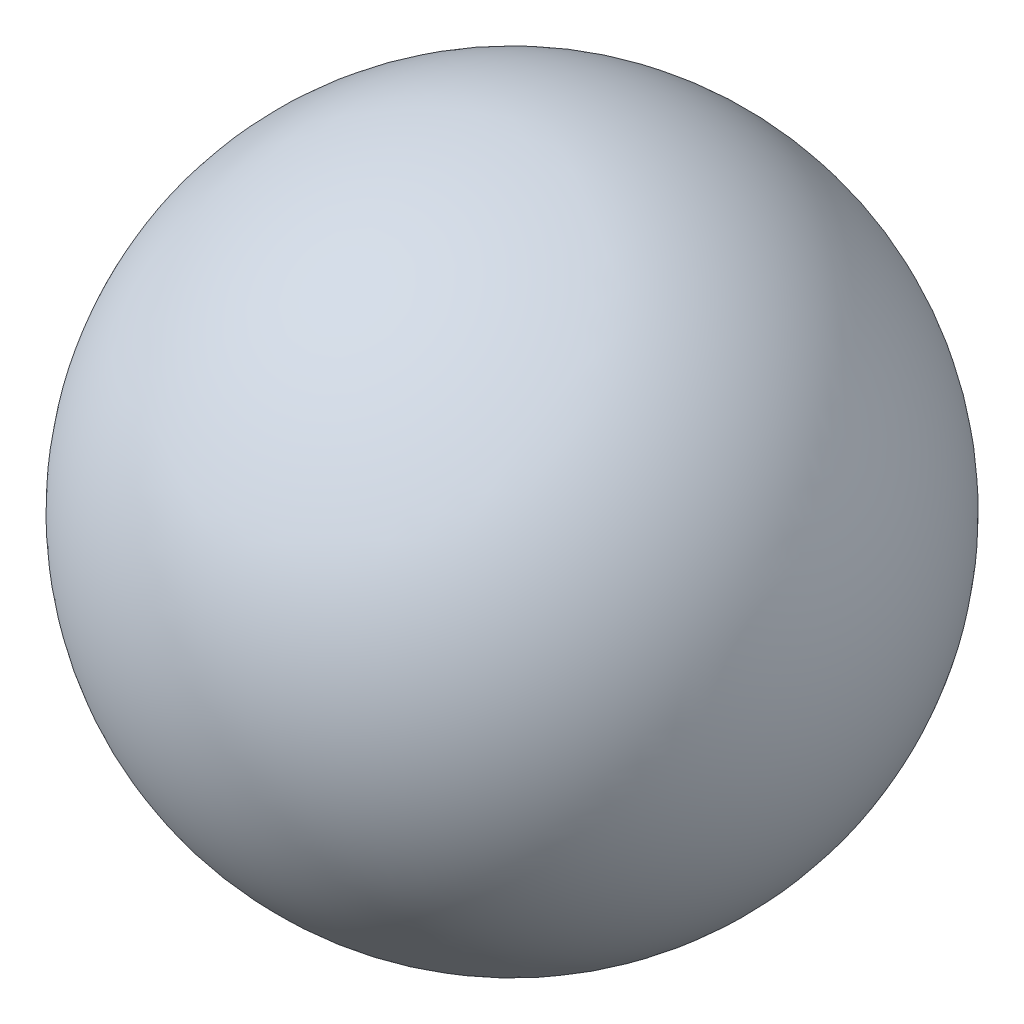
from build123d import *


with BuildPart() as part:
    # Sketch1 → Revolve2 (revolve)
    with BuildSketch(Plane.XY):
        with BuildLine():
            Line((12, 0), (-12, 0))
            ThreePointArc((-12, 0), (0, 12), (12, 0))
        make_face()
    revolve(axis=Axis((12, 0, 0), (-1, 0, 0)))


solid = part.part
